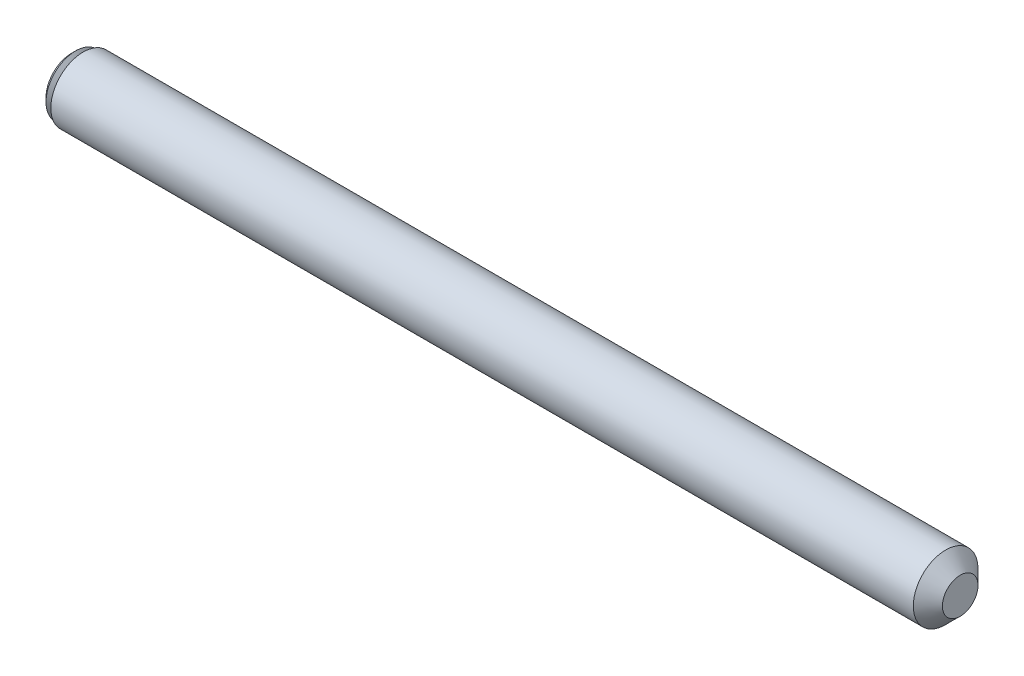
from build123d import *


with BuildPart() as part:
    # BodySke → BaseBody (revolve)
    with BuildSketch(Plane.XY, mode=Mode.PRIVATE) as basebody_sk:
        Polygon((0, 0), (0, 3.12928), (0.83947, 3.96875), (107.215649932, 3.96875), (108.999999932, 2.1844), (108.999999932, 0), align=None)
    revolve(basebody_sk.sketch.rotate(Axis((-12.7, 0, 0), (1, 0, 0)), 90), axis=Axis((-12.7, 0, 0), (1, 0, 0)))

    # ThdSchSke → ThreadSchematic (revolve, cut)
    with BuildSketch(Plane.XY):
        Polygon((0.83947, -3.12928), (0.251666778, -3.96875), (0.251666778, -4.9609375), (1.427273222, -4.9609375), (1.427273222, -3.96875), align=None)
    revolve(axis=Axis((-3.175, 0, 0), (1, 0, 0)), mode=Mode.SUBTRACT)


solid = part.part
